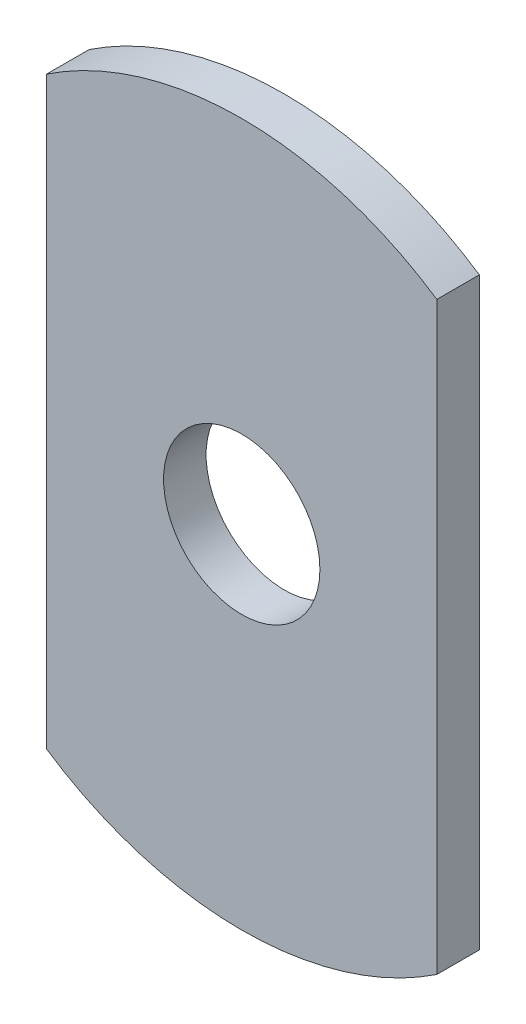
from build123d import *

# Parameters (mm, degrees)
SKETCH1_R      = 1.5875
EXTRUDE1_DEPTH = 0.8636


with BuildPart() as part:
    # Sketch1 → Extrude1 (new body)
    with BuildSketch(Plane.XY):
        with BuildLine():
            Line((-3.9624, 5.936485913), (-3.9624, -5.936485913))
            ThreePointArc((-3.9624, -5.936485913), (0, -7.1374), (3.9624, -5.936485913))
            Line((3.9624, -5.936485913), (3.9624, 5.936485913))
            ThreePointArc((3.9624, 5.936485913), (0, 7.1374), (-3.9624, 5.936485913))
        make_face()
        Circle(SKETCH1_R, mode=Mode.SUBTRACT)
    extrude(amount=-EXTRUDE1_DEPTH)


solid = part.part
